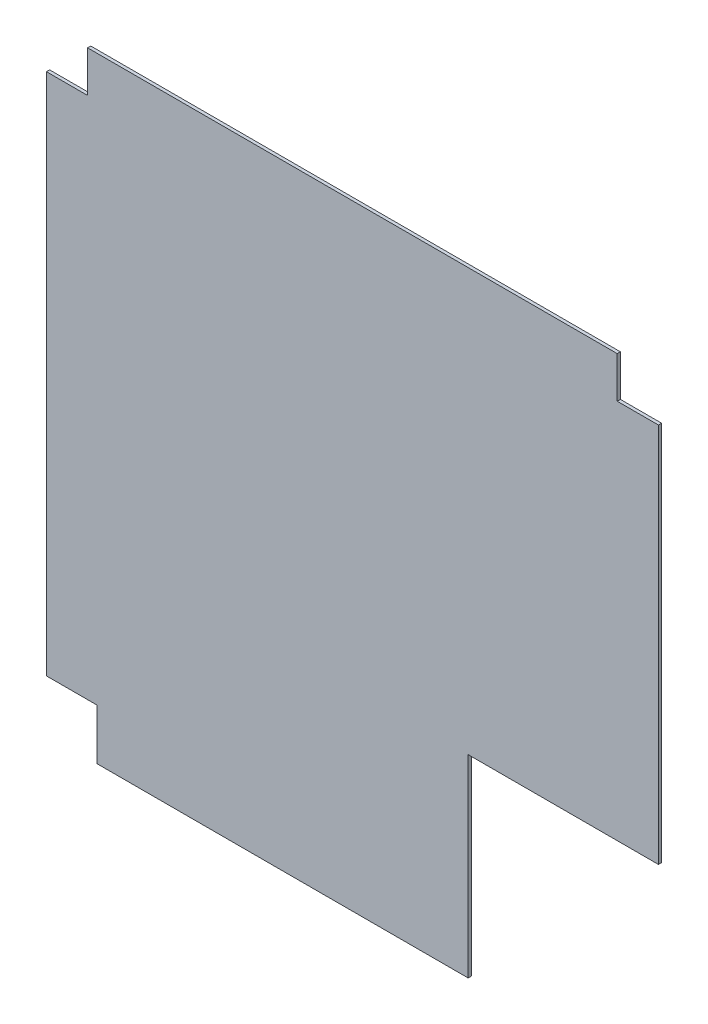
from build123d import *

# Parameters (mm, degrees)
SKETCH1_W           = 742.95
SKETCH1_H           = 615.95
BOSS_EXTRUDE1_DEPTH = 3.175
SKETCH2_W           = 41.275
SKETCH2_H           = 41.275
SKETCH2_W_2         = 50.8
SKETCH2_H_2         = 50.8
SKETCH2_W_3         = 190.5
SKETCH2_H_3         = 193.675
CUT_EXTRUDE1_DEPTH  = 483.54777678
SKETCH3_W           = 130.175
SKETCH3_H           = 615.95
CUT_EXTRUDE2_DEPTH  = 483.54777678


with BuildPart() as part:
    # Sketch1 → Boss-Extrude1 (new body)
    with BuildSketch(Plane.XY):
        Rectangle(SKETCH1_W, SKETCH1_H)
    extrude(amount=BOSS_EXTRUDE1_DEPTH)

    # Sketch2 → Cut-Extrude1 (cut, through all)
    with BuildSketch(Plane.XY.offset(3.175)):
        with Locations((-350.8375, 287.3375)):
            Rectangle(SKETCH2_W, SKETCH2_H)
        with Locations((-346.075, -282.575)):
            Rectangle(SKETCH2_W_2, SKETCH2_H_2)
        with Locations((220.6625, 287.3375)):
            Rectangle(SKETCH2_W, SKETCH2_H)
        with Locations((146.05, -211.1375)):
            Rectangle(SKETCH2_W_3, SKETCH2_H_3)
    extrude(amount=-CUT_EXTRUDE1_DEPTH, mode=Mode.SUBTRACT)

    # Sketch3 → Cut-Extrude2 (cut, through all)
    with BuildSketch(Plane.XY.offset(3.175)):
        with Locations((306.3875, 0)):
            Rectangle(SKETCH3_W, SKETCH3_H)
    extrude(amount=-CUT_EXTRUDE2_DEPTH, mode=Mode.SUBTRACT)


solid = part.part
